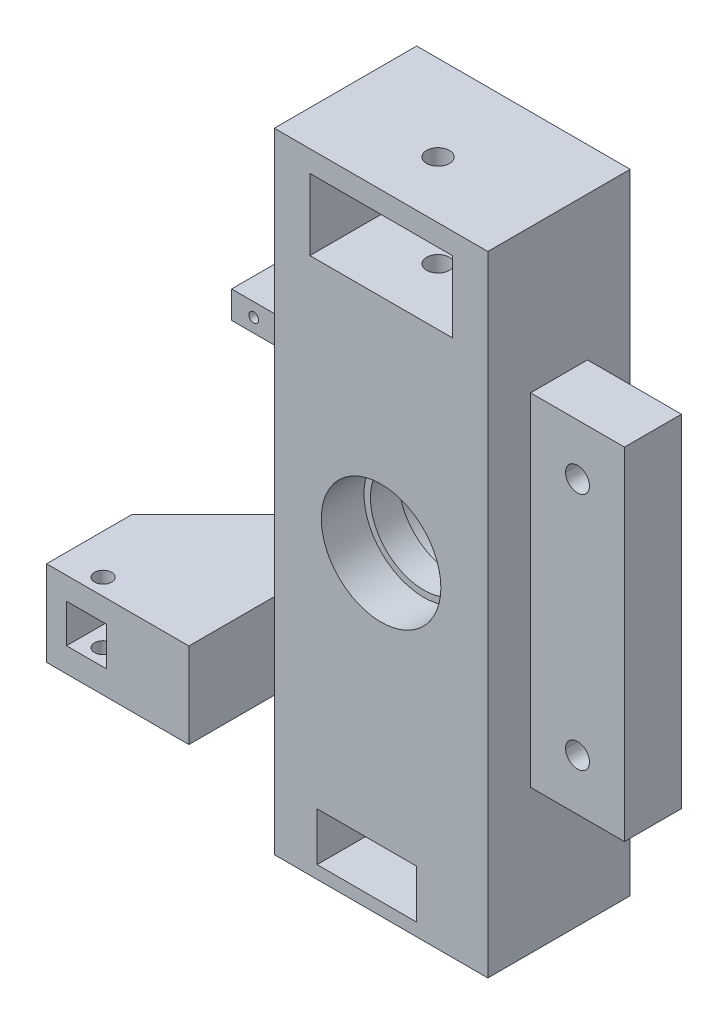
from build123d import *

# Parameters (mm, degrees)
SKETCH1_W                         = 75
SKETCH1_H                         = 50
BE_MAIN_UPRIGHT_BODY_DEPTH        = 221
SKETCH4_R                         = 18.75
CE_THROUGH_HOLE_DEPTH             = 230.667694724
SKETCH2_R                         = 21
CE_INNER_BEARING_DEPTH            = 15
SKETCH3_R                         = 23.5
CE_OUTER_BEARING_DEPTH            = 15
SKETCH7_W                         = 20
SKETCH7_H                         = 120
BE_CALIPER_MOUNT_DEPTH            = 33
SKETCH21_W                        = 30
SKETCH21_H                        = 9.582052631
BE_TEMP_SENSOR_MOUNT_V2_DEPTH     = 10
SKETCH9_W                         = 60
SKETCH9_H                         = 30
BE_TIE_ROD_MOUNT_DEPTH            = 50
SKETCH10_R                        = 4.2
CE_CALIPER_HOLES_DEPTH            = 242.91372429
SKETCH12_R                        = 4
CE_TOP_CLEVIS_HOLES_DEPTH         = 243.893495178
SKETCH33_W                        = 50
SKETCH33_H                        = 25
CE_SIMPLE_TOP_CLEVIS_SPACE_DEPTH  = 30
SKETCH34_R                        = 4
CUT_EXTRUDE12_DEPTH               = 42.5
SKETCH14_W                        = 25
SKETCH14_H                        = 12
CE_BOTTOM_CLEVIS_SPACE_DEPTH      = 243.893495178
SKETCH15_W                        = 25
SKETCH15_H                        = 5
CE_EXPAND_BOTTOM_CLEVIS_DEPTH     = 243.893495178
CE_WIDEN_BOTTOM_CLEVIS_DEPTH      = 240.74121548
CE_WIDEN_BOTTOM_CLEVIS_DEPTH_BACK = 240.74121548
SKETCH16_W                        = 10.007554032
SKETCH16_H                        = 17
CHAMFER1_SIZE                     = 30
SKETCH18_W                        = 14.04398123
SKETCH18_H                        = 13.562779604
CUT_EXTRUDE1_DEPTH                = 20
SKETCH19_R                        = 3
CUT_EXTRUDE2_DEPTH                = 177.032667423
SKETCH22_R                        = 1.7
CUT_EXTRUDE4_DEPTH                = 20
SKETCH31_R                        = 4
CUT_EXTRUDE9_DEPTH                = 31.5
SKETCH35_R                        = 21
CUT_EXTRUDE13_DEPTH               = 10


with BuildPart() as part:
    # Sketch1 → BE - main upright body (new body)
    with BuildSketch(Plane(origin=(0, 0, 0), x_dir=(1, 0, 0), z_dir=(0, 1, 0))):
        Rectangle(SKETCH1_W, SKETCH1_H)
    extrude(amount=BE_MAIN_UPRIGHT_BODY_DEPTH)

    # Sketch4 → CE - Through hole (cut, through all)
    with BuildSketch(Plane.XY.offset(25)):
        with Locations((0, 110.5)):
            Circle(SKETCH4_R)
    extrude(amount=-CE_THROUGH_HOLE_DEPTH, mode=Mode.SUBTRACT)

    # Sketch2 → CE - Inner bearing (cut)
    with BuildSketch(Plane.XY.offset(25)):
        with Locations((0, 110.5)):
            Circle(SKETCH2_R)
    extrude(amount=-CE_INNER_BEARING_DEPTH, mode=Mode.SUBTRACT)

    # Sketch3 → CE - Outer bearing (cut)
    with BuildSketch(Plane(origin=(0, 0, -25), x_dir=(-1, 0, 0), z_dir=(0, 0, -1))):
        with Locations((0, 110.5)):
            Circle(SKETCH3_R)
    extrude(amount=-CE_OUTER_BEARING_DEPTH, mode=Mode.SUBTRACT)

    # Sketch7 → BE - caliper mount (add)
    with BuildSketch(Plane(origin=(37.5, 0, 0), x_dir=(0, 0, -1), z_dir=(1, 0, 0))):
        with Locations((0, 110.5)):
            Rectangle(SKETCH7_W, SKETCH7_H)
    extrude(amount=BE_CALIPER_MOUNT_DEPTH)

    # Sketch21 → BE - temp sensor mount v2 (add, symmetric)
    with BuildSketch(Plane.XY):
        with Locations((-52.5, 144.811784304)):
            Rectangle(SKETCH21_W, SKETCH21_H)
    extrude(amount=BE_TEMP_SENSOR_MOUNT_V2_DEPTH, both=True)

    # Sketch9 → BE - tie rod mount (add)
    with BuildSketch(Plane.ZY.offset(37.5)):
        with Locations((25, 63.5)):
            Rectangle(SKETCH9_W, SKETCH9_H)
    extrude(amount=BE_TIE_ROD_MOUNT_DEPTH)

    # Sketch10 → CE - caliper holes (cut, through all)
    with BuildSketch(Plane.XY.offset(10)):
        with Locations((54, 152.5)):
            Circle(SKETCH10_R)
        with Locations((54, 68.5)):
            Circle(SKETCH10_R)
    extrude(amount=-CE_CALIPER_HOLES_DEPTH, mode=Mode.SUBTRACT)

    # Sketch12 → CE - top clevis holes (cut, through all)
    with BuildSketch(Plane.XY.offset(25)):
        with Locations((-12.5, 201)):
            Circle(SKETCH12_R)
        with Locations((12.5, 201)):
            Circle(SKETCH12_R)
    extrude(amount=-CE_TOP_CLEVIS_HOLES_DEPTH, mode=Mode.SUBTRACT)

    # Sketch33 → CE - simple top clevis space (cut)
    with BuildSketch(Plane.XY.offset(25)):
        with Locations((0, 201)):
            Rectangle(SKETCH33_W, SKETCH33_H)
    extrude(amount=-CE_SIMPLE_TOP_CLEVIS_SPACE_DEPTH, mode=Mode.SUBTRACT)

    # Sketch34 → Cut-Extrude12 (cut)
    with BuildSketch(Plane(origin=(0, 221, 0), x_dir=(1, 0, 0), z_dir=(0, 1, 0))):
        with Locations(Location((0, -5, 0), (0, 0, 90))):
            Circle(SKETCH34_R)
    extrude(amount=-CUT_EXTRUDE12_DEPTH, mode=Mode.SUBTRACT)

    # Sketch14 → CE - bottom clevis space (cut, through all)
    with BuildSketch(Plane.XY.offset(25)):
        with Locations((-9.98, 10.5)):
            Rectangle(SKETCH14_W, SKETCH14_H)
    extrude(amount=-CE_BOTTOM_CLEVIS_SPACE_DEPTH, mode=Mode.SUBTRACT)

    # Sketch15 → CE - expand bottom clevis (cut, through all)
    with BuildSketch(Plane.XY.offset(25)):
        with Locations((-9.98, 19)):
            Rectangle(SKETCH15_W, SKETCH15_H)
    extrude(amount=-CE_EXPAND_BOTTOM_CLEVIS_DEPTH, mode=Mode.SUBTRACT)

    # Sketch16 → CE - widen bottom clevis (cut, two sides: drawn at the far end of the back side and taken through both)
    with BuildSketch(Plane(origin=(2.52, 4.5, 25), x_dir=(1, 0, 0), z_dir=(0, 0, 1)).offset(-CE_WIDEN_BOTTOM_CLEVIS_DEPTH_BACK)):
        with Locations((5.003777016, 8.5)):
            Rectangle(SKETCH16_W, SKETCH16_H)
    extrude(amount=CE_WIDEN_BOTTOM_CLEVIS_DEPTH + CE_WIDEN_BOTTOM_CLEVIS_DEPTH_BACK, mode=Mode.SUBTRACT)

    # Chamfer1
    chamfer1_edges = [part.edges().sort_by_distance(p)[0] for p in [
        (-87.5, 63.5, -5),
    ]]
    chamfer(chamfer1_edges, length=CHAMFER1_SIZE)

    # Sketch18 → Cut-Extrude1 (cut)
    with BuildSketch(Plane.XY.offset(55)):
        with Locations((-73.48, 63.84)):
            Rectangle(SKETCH18_W, SKETCH18_H)
    extrude(amount=-CUT_EXTRUDE1_DEPTH, mode=Mode.SUBTRACT)

    # Sketch19 → Cut-Extrude2 (cut, through all)
    with BuildSketch(Plane(origin=(0, 78.5, 0), x_dir=(1, 0, 0), z_dir=(0, 1, 0))):
        with Locations(Location((-73.48, -49.15, 0), (0, 0, 270))):
            Circle(SKETCH19_R)
    extrude(amount=-CUT_EXTRUDE2_DEPTH, mode=Mode.SUBTRACT)

    # Sketch22 → Cut-Extrude4 (cut)
    with BuildSketch(Plane.XY.offset(10)):
        with Locations((-59.752411208, 144.811784303)):
            Circle(SKETCH22_R)
        with Locations((-49.752411208, 144.811784303)):
            Circle(SKETCH22_R)
    extrude(amount=-CUT_EXTRUDE4_DEPTH, mode=Mode.SUBTRACT)

    # Sketch31 → Cut-Extrude9 (cut)
    with BuildSketch(Plane.XZ):
        with Locations(Location((-9.98, -1.65, 0), (0, 0, 90))):
            Circle(SKETCH31_R)
    extrude(amount=-CUT_EXTRUDE9_DEPTH, mode=Mode.SUBTRACT)

    # Sketch35 → Cut-Extrude13 (cut)
    with BuildSketch(Plane.XY):
        with Locations((0, 110.5)):
            Circle(SKETCH35_R)
    extrude(amount=-CUT_EXTRUDE13_DEPTH, mode=Mode.SUBTRACT)


solid = part.part
